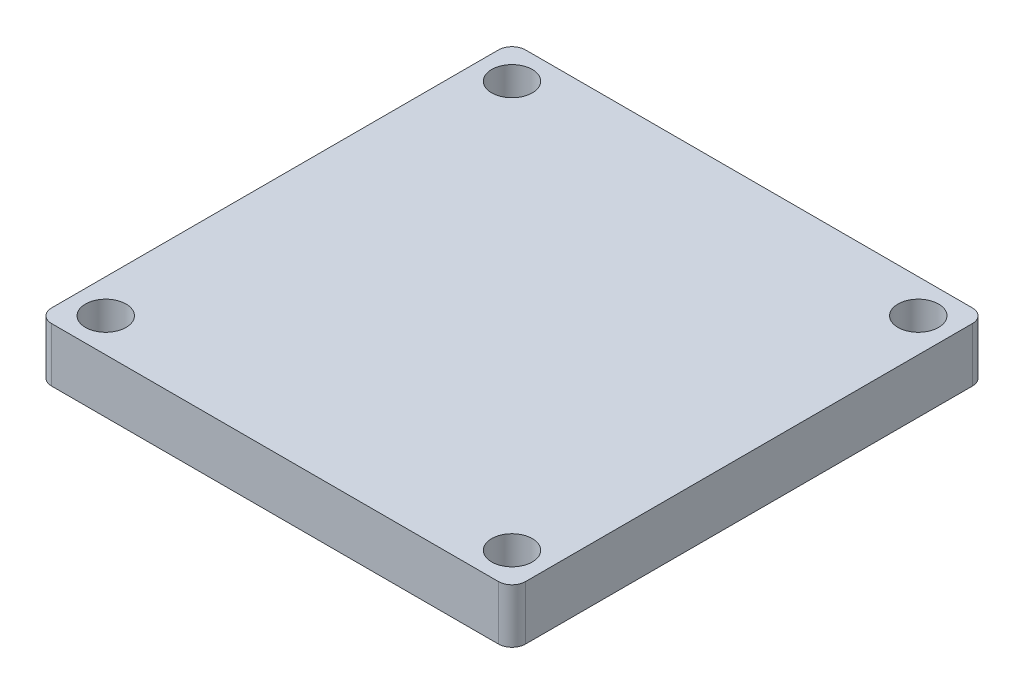
from build123d import *

# Parameters (mm, degrees)
SKETCH1_W           = 35
SKETCH1_H           = 35
SKETCH1_R           = 1.5
BOSS_EXTRUDE1_DEPTH = 4
FILLET3_R           = 1


with BuildPart() as part:
    # Sketch1 → Boss-Extrude1 (new body)
    with BuildSketch(Plane(origin=(0, 0, 0), x_dir=(1, 0, 0), z_dir=(0, 1, 0))):
        Rectangle(SKETCH1_W, SKETCH1_H)
        with Locations(Location((-15, 15, 0), (0, 0, 270))):
            Circle(SKETCH1_R, mode=Mode.SUBTRACT)
        with Locations(Location((15, 15, 0), (0, 0, 270))):
            Circle(SKETCH1_R, mode=Mode.SUBTRACT)
        with Locations(Location((-15, -15, 0), (0, 0, 270))):
            Circle(SKETCH1_R, mode=Mode.SUBTRACT)
        with Locations(Location((15, -15, 0), (0, 0, 270))):
            Circle(SKETCH1_R, mode=Mode.SUBTRACT)
    extrude(amount=BOSS_EXTRUDE1_DEPTH)

    # Fillet3
    fillet3_edges = [part.edges().sort_by_distance(p)[0] for p in [
        (17.5, 2, 17.5),
        (-17.5, 2, 17.5),
        (-17.5, 2, -17.5),
        (17.5, 2, -17.5),
    ]]
    fillet(fillet3_edges, radius=FILLET3_R)


solid = part.part
